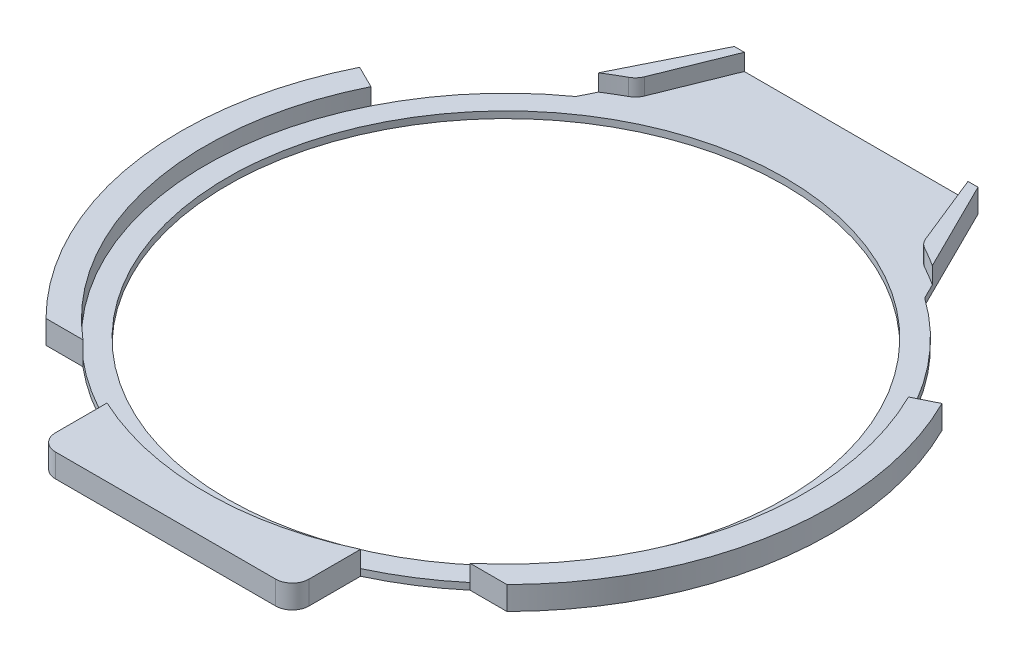
from build123d import *

# Parameters (mm, degrees)
SKETCH1_R           = 16.7
BOSS_EXTRUDE1_DEPTH = 0.4
BOSS_EXTRUDE3_DEPTH = 1
FILLET1_R           = 1


with BuildPart() as part:
    # Sketch1 → Boss-Extrude1 (new body)
    with BuildSketch(Plane(origin=(0, 0, 0), x_dir=(1, 0, 0), z_dir=(0, 1, 0))):
        with BuildLine():
            Line((-7.305730618, 21), (-10.009228055, 15.558449593))
            Line((-10.009228055, 15.558449593), (-10.461777167, 14.647566983))
            ThreePointArc((-10.461777167, 14.647566983), (-13.695076666, 11.68096208), (-16.11449254, 8.020170209))
            Line((-16.11449254, 8.020170209), (-17.457366918, 8.688517726))
            ThreePointArc((-17.457366918, 8.688517726), (-19.248737127, -3.120275469), (-13.818649167, -13.758449593))
            Line((-13.818649167, -13.758449593), (-11.606251109, -13.758449593))
            ThreePointArc((-11.606251109, -13.758449593), (-9.687950737, -15.170484848), (-7.6, -16.316862443))
            Line((-7.6, -16.316862443), (-7.6, -20.407699946))
            Line((-7.6, -20.407699946), (7.6, -20.407699946))
            Line((7.6, -20.407699946), (7.6, -16.316862443))
            ThreePointArc((7.6, -16.316862443), (9.687950737, -15.170484848), (11.606251109, -13.758449593))
            Line((11.606251109, -13.758449593), (13.818649167, -13.758449593))
            ThreePointArc((13.818649167, -13.758449593), (19.248737127, -3.120275469), (17.457366918, 8.688517726))
            Line((17.457366918, 8.688517726), (16.11449254, 8.020170209))
            ThreePointArc((16.11449254, 8.020170209), (13.695076666, 11.68096208), (10.461777167, 14.647566983))
            Line((10.461777167, 14.647566983), (10.009228055, 15.558449593))
            Line((10.009228055, 15.558449593), (7.305730618, 21))
            Line((7.305730618, 21), (-7.305730618, 21))
        make_face()
        with Locations(Location((0, 0, 0), (0, 0, 270))):
            Circle(SKETCH1_R, mode=Mode.SUBTRACT)
    extrude(amount=BOSS_EXTRUDE1_DEPTH)

    # Sketch2 → Boss-Extrude3 (add)
    with BuildSketch(Plane(origin=(0, 0.4, 0), x_dir=(1, 0, 0), z_dir=(0, 1, 0))):
        with BuildLine():
            Line((-8.56095789, 16.4), (-6.705730618, 21))
            Line((-6.705730618, 21), (-7.305730618, 21))
            Line((-7.305730618, 21), (-10.009228055, 15.558449593))
            ThreePointArc((-10.009228055, 15.558449593), (-9.294622278, 15.995624299), (-8.56095789, 16.4))
        make_face()
        with BuildLine():
            Line((8.56095789, 16.4), (6.705730618, 21))
            Line((6.705730618, 21), (7.305730618, 21))
            Line((7.305730618, 21), (10.009228055, 15.558449593))
            ThreePointArc((10.009228055, 15.558449593), (9.294622278, 15.995624299), (8.56095789, 16.4))
        make_face()
        with BuildLine():
            Line((-7.6, -20.407699946), (7.6, -20.407699946))
            Line((7.6, -20.407699946), (7.6, -16.316862443))
            ThreePointArc((7.6, -16.316862443), (0, -18), (-7.6, -16.316862443))
            Line((-7.6, -16.316862443), (-7.6, -20.407699946))
        make_face()
        with BuildLine():
            Line((-16.11449254, 8.020170209), (-17.457366918, 8.688517726))
            ThreePointArc((-17.457366918, 8.688517726), (-19.248737127, -3.120275469), (-13.818649167, -13.758449593))
            Line((-13.818649167, -13.758449593), (-11.606251109, -13.758449593))
            ThreePointArc((-11.606251109, -13.758449593), (-17.626314908, -3.648701519), (-16.11449254, 8.020170209))
        make_face()
        with BuildLine():
            Line((17.457366918, 8.688517726), (16.11449254, 8.020170209))
            ThreePointArc((16.11449254, 8.020170209), (17.626314908, -3.648701519), (11.606251109, -13.758449593))
            Line((11.606251109, -13.758449593), (13.818649167, -13.758449593))
            ThreePointArc((13.818649167, -13.758449593), (19.248737127, -3.120275469), (17.457366918, 8.688517726))
        make_face()
    extrude(amount=BOSS_EXTRUDE3_DEPTH)

    # Fillet1
    fillet1_edges = [part.edges().sort_by_distance(p)[0] for p in [
        (7.6, 0.7, 20.407699946),
        (-7.6, 0.7, 20.407699946),
        (-8.56095789, 0.9, -16.4),
        (8.56095789, 0.9, -16.4),
    ]]
    fillet(fillet1_edges, radius=FILLET1_R)


solid = part.part
